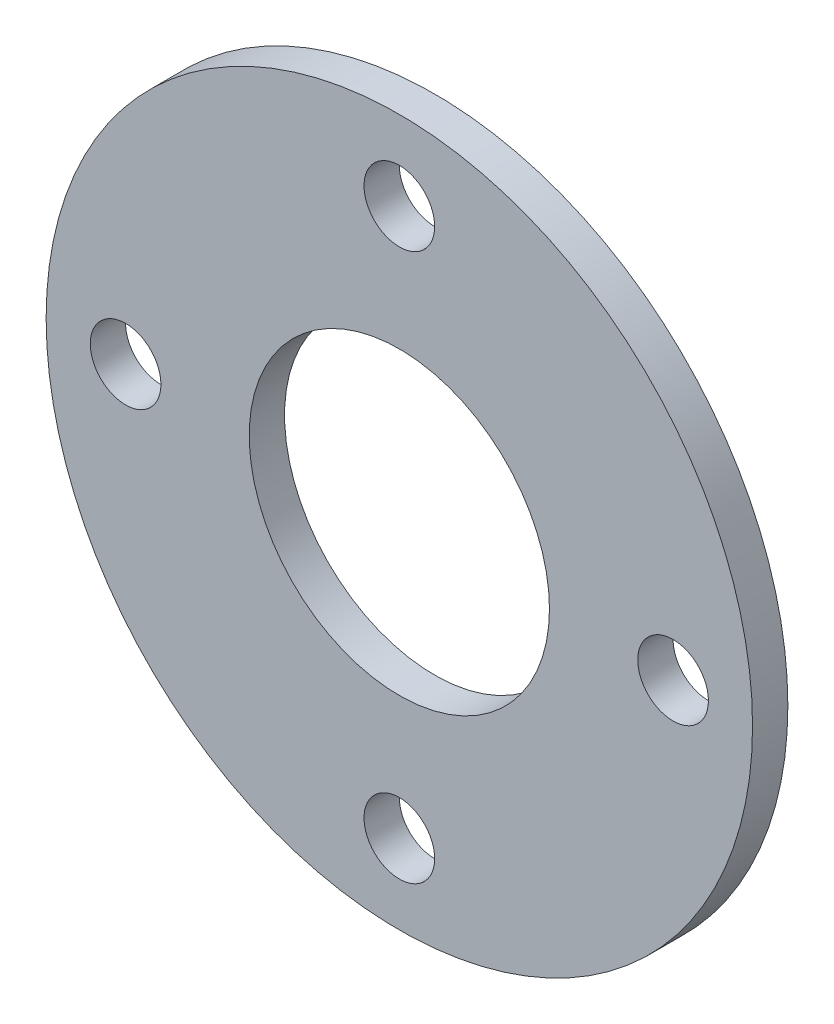
from build123d import *

# Parameters (mm, degrees)
SKETCH_2_R      = 20
SKETCH_2_R_2    = 8.5
SKETCH_2_R_3    = 2
EXTRUDE_1_DEPTH = 2


with BuildPart() as part:
    # 草图2 → 凸台-拉伸1 (new body)
    with BuildSketch(Plane.XY):
        Circle(SKETCH_2_R)
        Circle(SKETCH_2_R_2, mode=Mode.SUBTRACT)
        with Locations((0, 15.5)):
            Circle(SKETCH_2_R_3, mode=Mode.SUBTRACT)
        with Locations((0, -15.5)):
            Circle(SKETCH_2_R_3, mode=Mode.SUBTRACT)
        with Locations((15.5, 0)):
            Circle(SKETCH_2_R_3, mode=Mode.SUBTRACT)
        with Locations((-15.5, 0)):
            Circle(SKETCH_2_R_3, mode=Mode.SUBTRACT)
    extrude(amount=EXTRUDE_1_DEPTH)


solid = part.part
